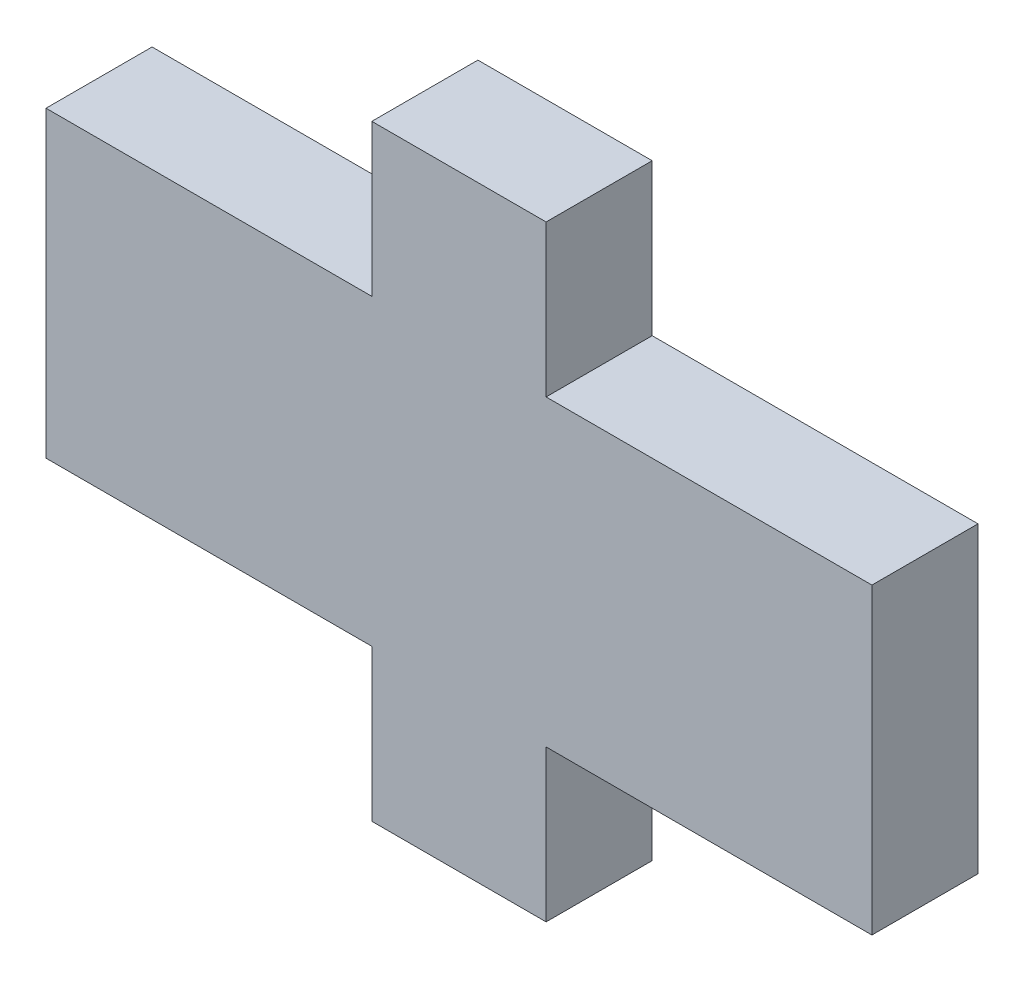
from build123d import *

# Parameters (mm, degrees)
BOSS_EXTRUDE1_DEPTH = 28


with BuildPart() as part:
    # Sketch2 → Boss-Extrude1 (new body)
    with BuildSketch(Plane.XY):
        Polygon((-109, -42.5), (-23, -42.5), (-23, -82.5), (23, -82.5), (23, -42.5), (109, -42.5), (109, 37.5), (23, 37.5), (23, 77.5), (-23, 77.5), (-23, 37.5), (-109, 37.5), align=None)
    extrude(amount=BOSS_EXTRUDE1_DEPTH)


solid = part.part
